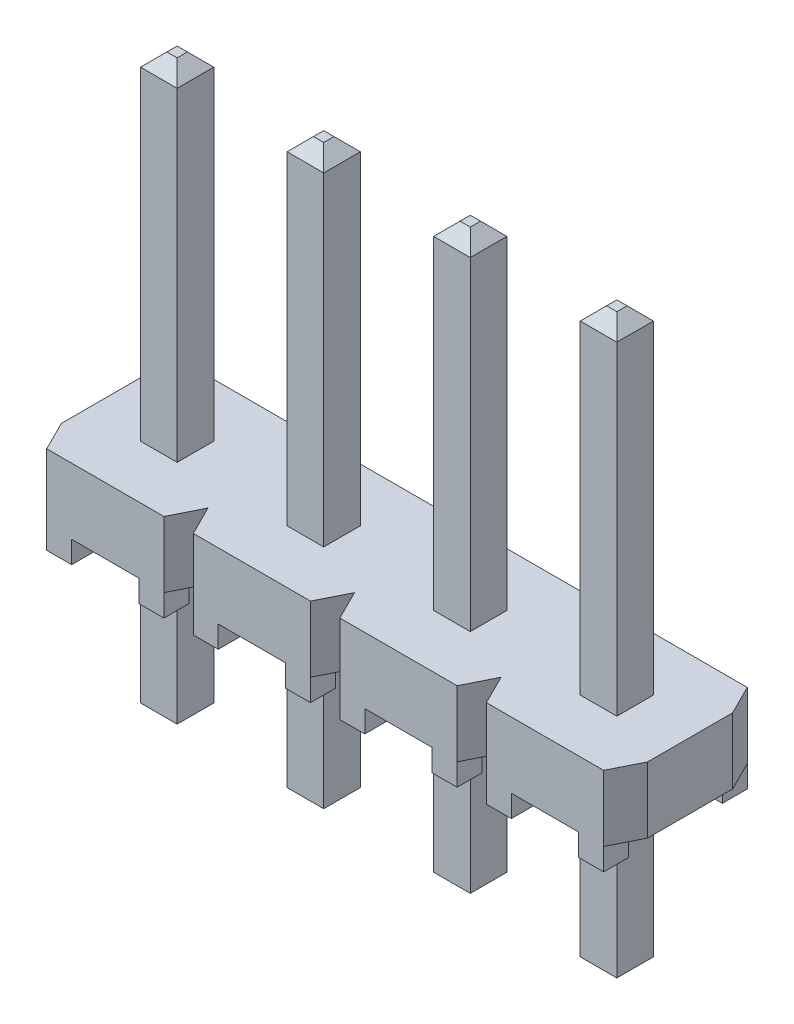
from build123d import *

# Parameters (mm, degrees)
SKETCH1_W                        = 10.16
SKETCH1_H                        = 2.4892
BASE_EXTRUDE_DEPTH               = 0.5715
SNAP_GROOVES_DEPTH               = 6.353678937
SKETCH4_W                        = 0.4318
SKETCH4_H                        = 0.4318
STANDOFFS_DEPTH                  = 0.381
POSITION_PATTERN_COUNT           = 4
POSITION_PATTERN_PITCH           = 2.54
SKETCH5_W                        = 0.635
SKETCH5_H                        = 10
TERMINAL_TH_DEPTH                = 0.3175
T1_TIP1_SIZE                     = 0.2286
TERMINAL_PATTERN_COUNT           = 4
TERMINAL_PATTERN_PITCH           = 2.54
T1_TIP1_OF_TERMINAL_PATTERN_SIZE = 0.2286


with BuildPart() as part:
    # Sketch1 → Base-Extrude (new, symmetric)
    with BuildSketch(Plane(origin=(0, 0, 0), x_dir=(1, 0, 0), z_dir=(0, 1, 0))):
        Rectangle(SKETCH1_W, SKETCH1_H)
    extrude(amount=BASE_EXTRUDE_DEPTH, both=True)

    # Sketch3 → Snap Grooves (cut, through all)
    with BuildSketch(Plane(origin=(0, 0.5715, 0), x_dir=(-1, 0, 0), z_dir=(0, 1, 0))):
        Polygon((2.286, 1.2446), (2.794, 1.2446), (2.54, 0.7366), align=None)
        Polygon((2.286, -1.2446), (2.794, -1.2446), (2.54, -0.7366), align=None)
        Polygon((5.08, -0.7366), (5.334, -1.2446), (4.826, -1.2446), align=None)
        Polygon((5.08, 0.7366), (5.334, 1.2446), (4.826, 1.2446), align=None)
    snap_grooves = extrude(amount=-SNAP_GROOVES_DEPTH, mode=Mode.SUBTRACT)

    # Sketch4 → Standoffs (add)
    with BuildSketch(Plane.XZ.offset(0.5715)):
        with Locations((-4.6101, 1.0287)):
            Rectangle(SKETCH4_W, SKETCH4_H)
        with Locations((-3.0099, 1.0287)):
            Rectangle(SKETCH4_W, SKETCH4_H)
        with Locations((-3.0099, -1.0287)):
            Rectangle(SKETCH4_W, SKETCH4_H)
        with Locations((-4.6101, -1.0287)):
            Rectangle(SKETCH4_W, SKETCH4_H)
    standoffs = extrude(amount=STANDOFFS_DEPTH)

    # Position Pattern: Snap Grooves, Standoffs ×4
    with Locations(*[(i * POSITION_PATTERN_PITCH, 0, 0) for i in range(1, POSITION_PATTERN_COUNT)]):
        add(snap_grooves, mode=Mode.SUBTRACT)
        add(standoffs)

    # Sketch5 → Terminal -TH (add, symmetric)
    with BuildSketch(Plane.ZY.offset(3.81)):
        with Locations((0, 1.4135)):
            Rectangle(SKETCH5_W, SKETCH5_H)
    terminal_th = extrude(amount=TERMINAL_TH_DEPTH, both=True)

    # T1 Tip1
    t1_tip1_edges = [part.edges().sort_by_distance(p)[0] for p in [
        (-3.81, -3.5865, 0.3175),
        (-4.1275, -3.5865, 0),
        (-3.81, 6.4135, -0.3175),
        (-3.4925, -3.5865, 0),
        (-3.81, -3.5865, -0.3175),
        (-3.4925, 6.4135, 0),
        (-3.81, 6.4135, 0.3175),
        (-4.1275, 6.4135, 0),
    ]]
    chamfer(t1_tip1_edges, length=T1_TIP1_SIZE)

    # Terminal Pattern: Terminal -TH ×4
    with Locations(*[(i * TERMINAL_PATTERN_PITCH, 0, 0) for i in range(1, TERMINAL_PATTERN_COUNT)]):
        add(terminal_th)

    # T1 Tip1 of Terminal Pattern
    t1_tip1_of_terminal_pattern_edges = [part.edges().sort_by_distance(p)[0] for p in [
        (-1.27, -3.5865, 0.3175),
        (-1.5875, -3.5865, 0),
        (-1.27, 6.4135, -0.3175),
        (-0.9525, -3.5865, 0),
        (-1.27, -3.5865, -0.3175),
        (-0.9525, 6.4135, 0),
        (-1.27, 6.4135, 0.3175),
        (-1.5875, 6.4135, 0),
        (1.27, -3.5865, 0.3175),
        (0.9525, -3.5865, 0),
        (1.27, 6.4135, -0.3175),
        (1.5875, -3.5865, 0),
        (1.27, -3.5865, -0.3175),
        (1.5875, 6.4135, 0),
        (1.27, 6.4135, 0.3175),
        (0.9525, 6.4135, 0),
        (3.81, -3.5865, 0.3175),
        (3.4925, -3.5865, 0),
        (3.81, 6.4135, -0.3175),
        (4.1275, -3.5865, 0),
        (3.81, -3.5865, -0.3175),
        (4.1275, 6.4135, 0),
        (3.81, 6.4135, 0.3175),
        (3.4925, 6.4135, 0),
    ]]
    chamfer(t1_tip1_of_terminal_pattern_edges, length=T1_TIP1_OF_TERMINAL_PATTERN_SIZE)


solid = part.part
